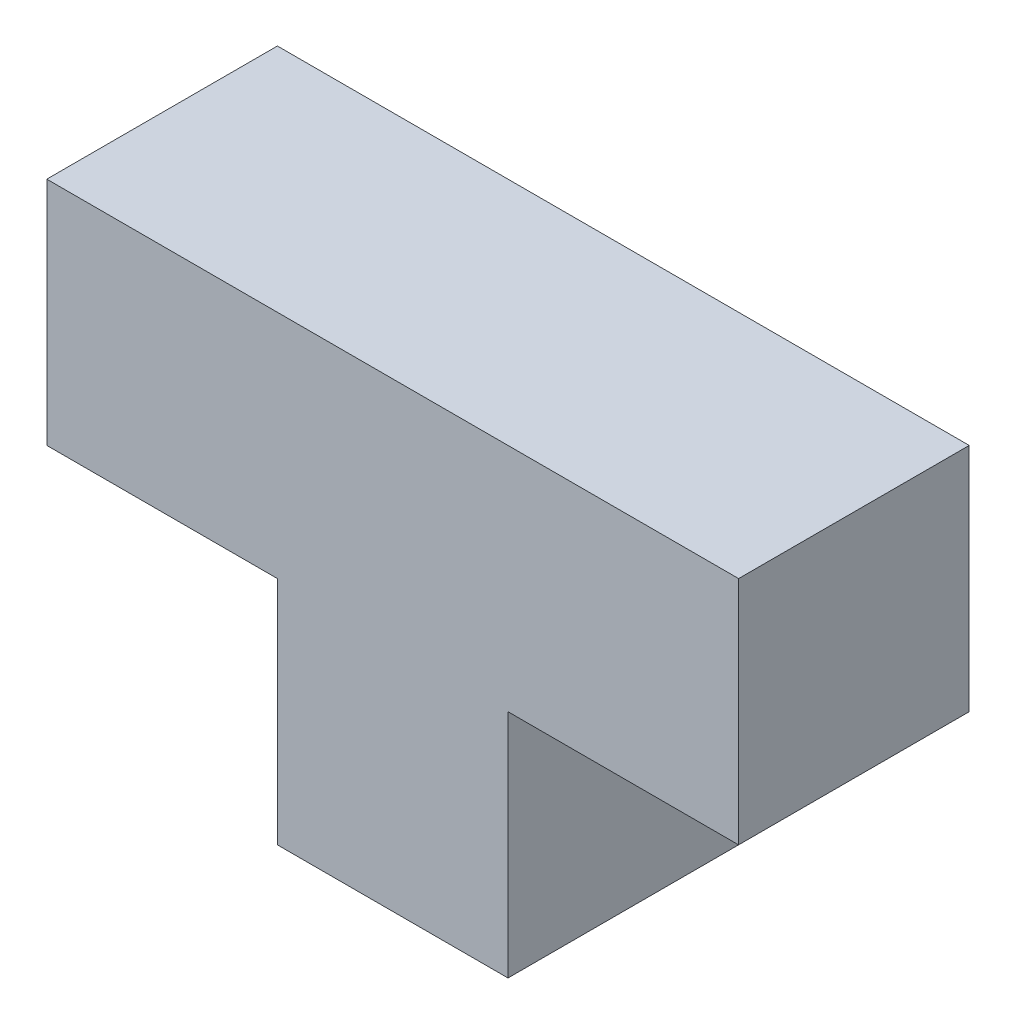
from build123d import *

# Parameters (mm, degrees)
BOSS_EXTRUDE1_DEPTH = 19.05


with BuildPart() as part:
    # Sketch1 → Boss-Extrude1 (new body)
    with BuildSketch(Plane.XY):
        Polygon((0, 0), (0, 19.05), (-19.05, 19.05), (-19.05, 38.1), (38.1, 38.1), (38.1, 19.05), (19.05, 19.05), (19.05, 0), align=None)
    extrude(amount=BOSS_EXTRUDE1_DEPTH)


solid = part.part
